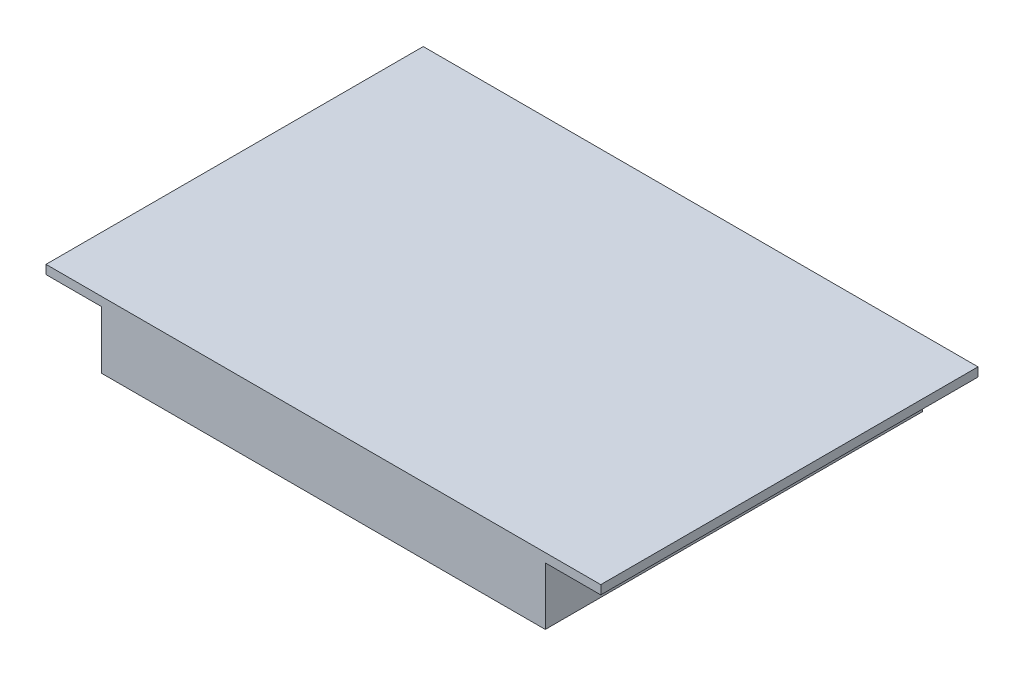
from build123d import *

# Parameters (mm, degrees)
SKETCH1_W           = 200
SKETCH1_H           = 30
SKETCH1_W_2         = 25
SKETCH1_H_2         = 4
BOSS_EXTRUDE1_DEPTH = 85


with BuildPart() as part:
    # Sketch1 → Boss-Extrude1 (new, symmetric)
    with BuildSketch(Plane.XY):
        Rectangle(SKETCH1_W, SKETCH1_H)
        with Locations((-112.5, 13)):
            Rectangle(SKETCH1_W_2, SKETCH1_H_2)
        with Locations((112.5, 13)):
            Rectangle(SKETCH1_W_2, SKETCH1_H_2)
    extrude(amount=BOSS_EXTRUDE1_DEPTH, both=True)


solid = part.part
